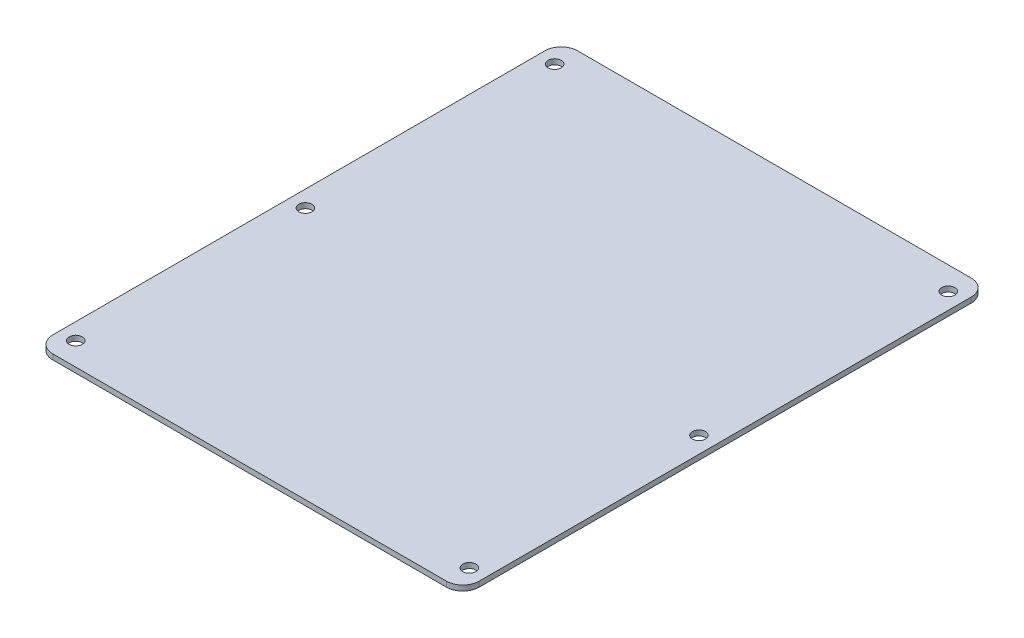
from build123d import *

# Parameters (mm, degrees)
ESQUISSE1_W             = 130
ESQUISSE1_H             = 160
BOSS_EXTRU_1_DEPTH      = 1.6
ESQUISSE2_R             = 2
ENL_V_MAT_EXTRU_1_DEPTH = 104.090057717
CONG_1_R                = 5


with BuildPart() as part:
    # Esquisse1 → Boss.-Extru.1 (new body)
    with BuildSketch(Plane(origin=(0, 0, 0), x_dir=(1, 0, 0), z_dir=(0, 1, 0))):
        Rectangle(ESQUISSE1_W, ESQUISSE1_H)
    extrude(amount=BOSS_EXTRU_1_DEPTH)

    # Esquisse2 → Enlèv. mat.-Extru.1 (cut, through all)
    with BuildSketch(Plane(origin=(0, 1.6, 0), x_dir=(1, 0, 0), z_dir=(0, 1, 0))):
        with Locations(Location((-60, 73, 0), (0, 0, 270))):
            Circle(ESQUISSE2_R)
        with Locations(Location((-60, -3, 0), (0, 0, 270))):
            Circle(ESQUISSE2_R)
        with Locations(Location((-60, -73, 0), (0, 0, 270))):
            Circle(ESQUISSE2_R)
        with Locations(Location((60, -73, 0), (0, 0, 90))):
            Circle(ESQUISSE2_R)
        with Locations(Location((60, -3, 0), (0, 0, 90))):
            Circle(ESQUISSE2_R)
        with Locations(Location((60, 73, 0), (0, 0, 90))):
            Circle(ESQUISSE2_R)
    extrude(amount=-ENL_V_MAT_EXTRU_1_DEPTH, mode=Mode.SUBTRACT)

    # Congé1
    cong_1_edges = [part.edges().sort_by_distance(p)[0] for p in [
        (65, 0.8, 80),
        (-65, 0.8, 80),
        (-65, 0.8, -80),
        (65, 0.8, -80),
    ]]
    fillet(cong_1_edges, radius=CONG_1_R)


solid = part.part
